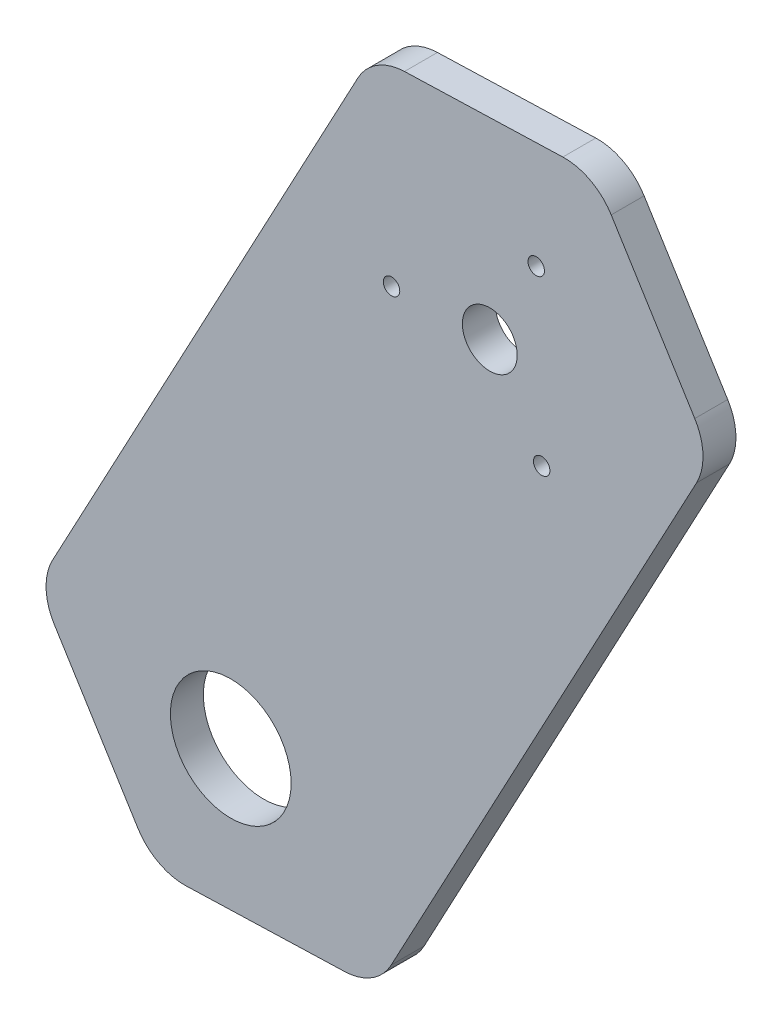
from build123d import *

# Parameters (mm, degrees)
SKETCH1_R           = 11
SKETCH1_R_2         = 1.5
SKETCH1_R_3         = 5
BOSS_EXTRUDE1_DEPTH = 6


with BuildPart() as part:
    # Sketch1 → Boss-Extrude1 (new body)
    with BuildSketch(Plane.XY):
        with BuildLine():
            Line((32.761702384, 392.691187588), (61.614432832, 393.614918623))
            ThreePointArc((61.614432832, 393.614918623), (66.654742846, 392.435853651), (70.430246875, 388.894598426))
            Line((70.430246875, 388.894598426), (85.656586641, 364.369266407))
            ThreePointArc((85.656586641, 364.369266407), (87.15564143, 359.414697406), (85.976576458, 354.374387393))
            Line((85.976576458, 354.374387393), (30.339336025, 250.464579356))
            ThreePointArc((30.339336025, 250.464579356), (26.7980808, 246.689075327), (21.843511799, 245.190020539))
            Line((21.843511799, 245.190020539), (-7.009218649, 244.266289504))
            ThreePointArc((-7.009218649, 244.266289504), (-12.049528663, 245.445354475), (-15.825032692, 248.9866097))
            Line((-15.825032692, 248.9866097), (-31.051372458, 273.511941719))
            ThreePointArc((-31.051372458, 273.511941719), (-32.550427247, 278.46651072), (-31.371362275, 283.506820734))
            Line((-31.371362275, 283.506820734), (24.265878158, 387.41662877))
            ThreePointArc((24.265878158, 387.41662877), (27.807133383, 391.192132799), (32.761702384, 392.691187588))
        make_face()
        with Locations((1.104829999, 270.012836125)):
            Circle(SKETCH1_R, mode=Mode.SUBTRACT)
        with Locations((57.758509759, 342.948926532)):
            Circle(SKETCH1_R_2, mode=Mode.SUBTRACT)
        with Locations((56.765475088, 373.966355411)):
            Circle(SKETCH1_R_2, mode=Mode.SUBTRACT)
        with Locations((30.400111055, 357.59764772)):
            Circle(SKETCH1_R_2, mode=Mode.SUBTRACT)
        with Locations((48.308031967, 358.170976554)):
            Circle(SKETCH1_R_3, mode=Mode.SUBTRACT)
    extrude(amount=BOSS_EXTRUDE1_DEPTH)


solid = part.part
